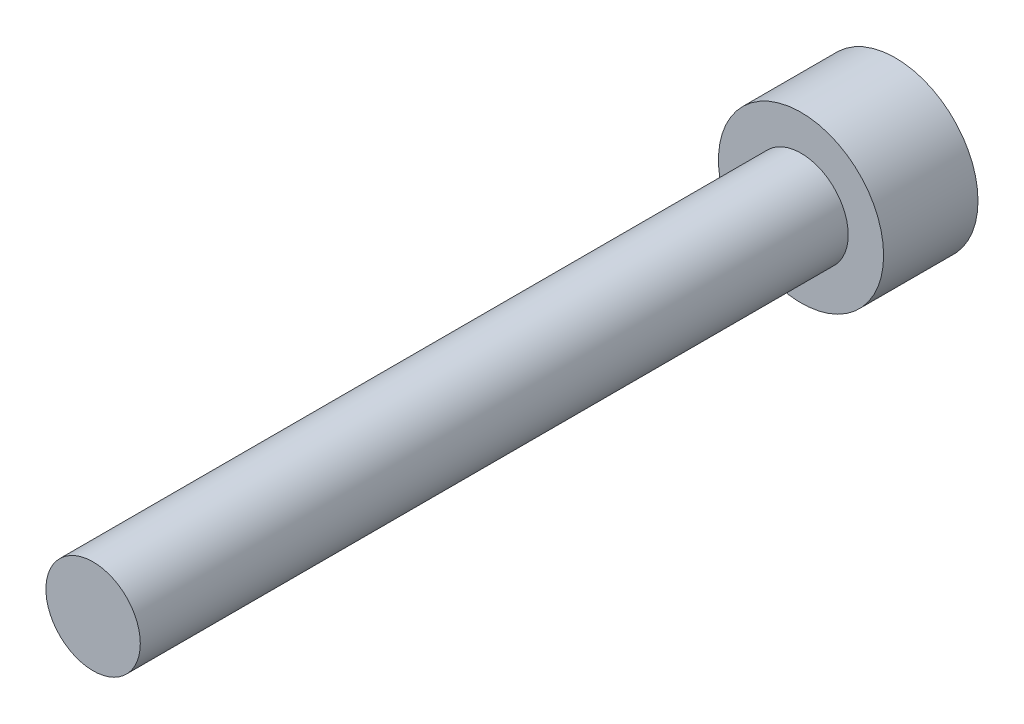
from build123d import *

# Parameters (mm, degrees)
CABEZA_START            = -4
CROQUIS1_R              = 3.5
CABEZA_DEPTH            = 4
CROQUIS2_R              = 2
CUERPO_DEPTH            = 30
HEXAGONO_INTERIOR_START = -4
HEXAGONO_INTERIOR_DEPTH = 2


with BuildPart() as part:
    # Croquis1 → Cabeza (new body)
    with BuildSketch(Plane.XY.offset(CABEZA_START)):
        Circle(CROQUIS1_R)
    extrude(amount=CABEZA_DEPTH)

    # Croquis2 → Cuerpo (add)
    with BuildSketch(Plane.XY):
        Circle(CROQUIS2_R)
    extrude(amount=CUERPO_DEPTH)

    # Croquis3 → Hexagono_interior (cut)
    with BuildSketch(Plane.XY.offset(HEXAGONO_INTERIOR_START)):
        Polygon((1.732050808, 0), (0.866025404, 1.5), (-0.866025404, 1.5), (-1.732050808, 0), (-0.866025404, -1.5), (0.866025404, -1.5), align=None)
    extrude(amount=HEXAGONO_INTERIOR_DEPTH, mode=Mode.SUBTRACT)


solid = part.part
